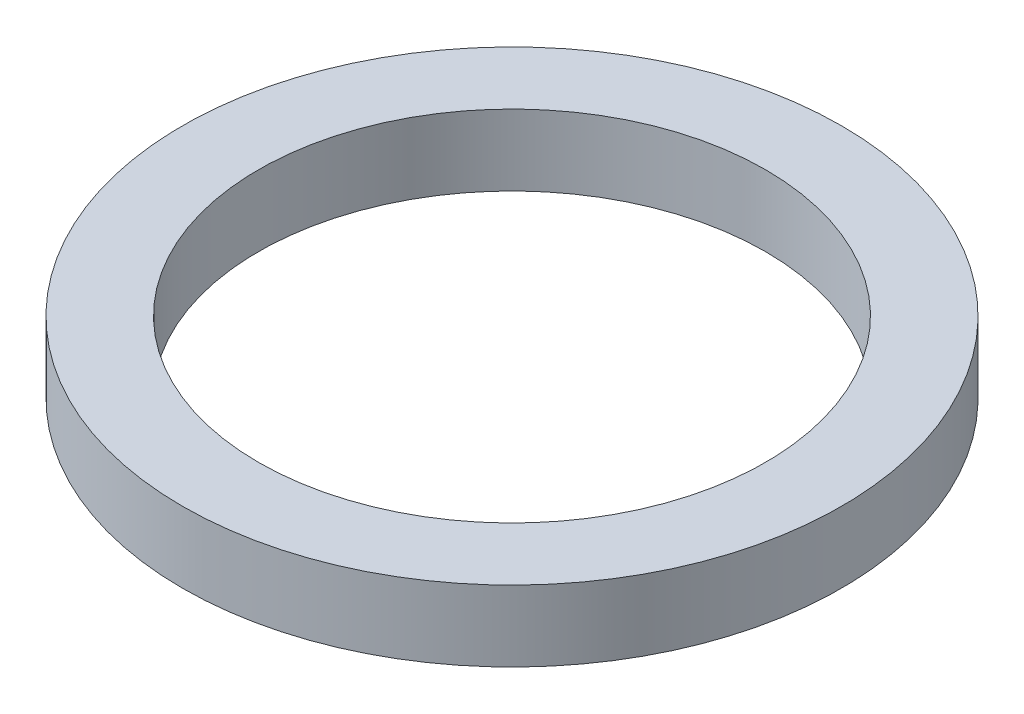
from build123d import *

# Parameters (mm, degrees)
SKETCH1_R           = 32.5
SKETCH1_R_2         = 25
BOSS_EXTRUDE1_DEPTH = 7


with BuildPart() as part:
    # Sketch1 → Boss-Extrude1 (new body)
    with BuildSketch(Plane(origin=(0, 0, 0), x_dir=(1, 0, 0), z_dir=(0, 1, 0))):
        with Locations(Location((0, 0, 0), (0, 0, 270))):
            Circle(SKETCH1_R)
        with Locations(Location((0, 0, 0), (0, 0, 270))):
            Circle(SKETCH1_R_2, mode=Mode.SUBTRACT)
    extrude(amount=BOSS_EXTRUDE1_DEPTH)


solid = part.part
